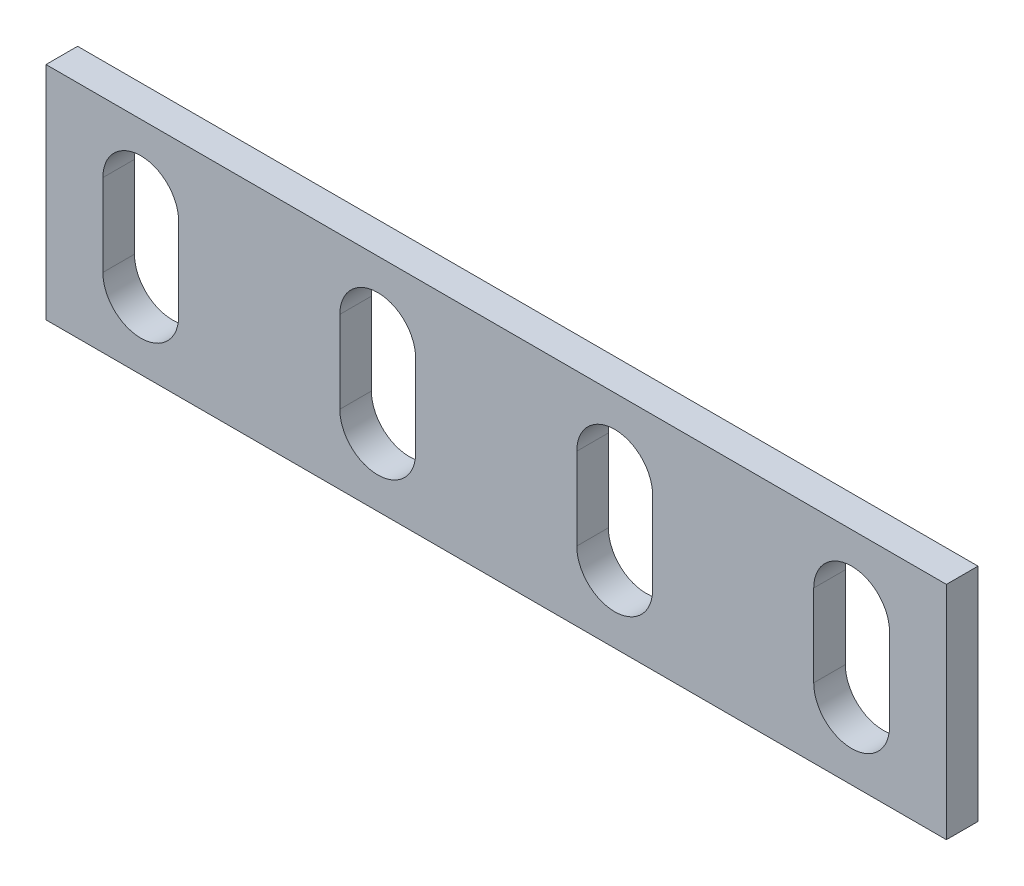
from build123d import *

# Parameters (mm, degrees)
SKETCH1_W           = 570
SKETCH1_H           = 140
BOSS_EXTRUDE1_DEPTH = 20


with BuildPart() as part:
    # Sketch1 → Boss-Extrude1 (new body)
    with BuildSketch(Plane.XY):
        Rectangle(SKETCH1_W, SKETCH1_H)
        with BuildLine():
            Line((99, 26), (99, -26))
            ThreePointArc((99, -26), (75, -50), (51, -26))
            Line((51, -26), (51, 26))
            ThreePointArc((51, 26), (75, 50), (99, 26))
        make_face(mode=Mode.SUBTRACT)
        with BuildLine():
            Line((249, 26), (249, -26))
            ThreePointArc((249, -26), (225, -50), (201, -26))
            Line((201, -26), (201, 26))
            ThreePointArc((201, 26), (225, 50), (249, 26))
        make_face(mode=Mode.SUBTRACT)
        with BuildLine():
            Line((-99, 26), (-99, -26))
            ThreePointArc((-99, -26), (-75, -50), (-51, -26))
            Line((-51, -26), (-51, 26))
            ThreePointArc((-51, 26), (-75, 50), (-99, 26))
        make_face(mode=Mode.SUBTRACT)
        with BuildLine():
            Line((-249, 26), (-249, -26))
            ThreePointArc((-249, -26), (-225, -50), (-201, -26))
            Line((-201, -26), (-201, 26))
            ThreePointArc((-201, 26), (-225, 50), (-249, 26))
        make_face(mode=Mode.SUBTRACT)
    extrude(amount=BOSS_EXTRUDE1_DEPTH)


solid = part.part
